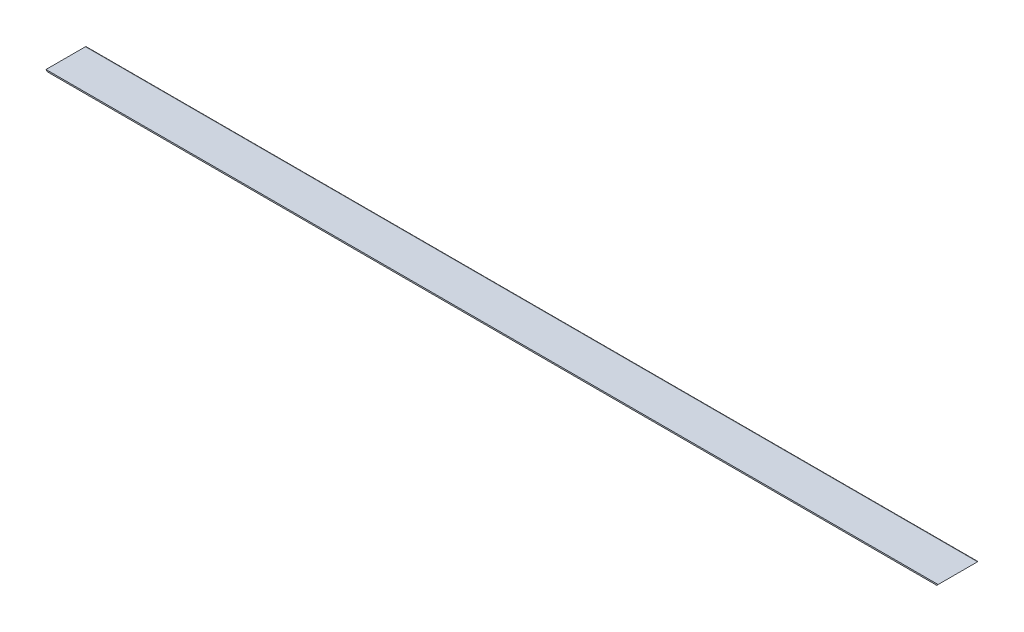
from build123d import *

# Parameters (mm, degrees)
BOSS_EXTRUDE1_DEPTH = 1930
FILLET1_R           = 3
CUT_EXTRUDE1_DEPTH  = 88
CUT_EXTRUDE2_DEPTH  = 88


with BuildPart() as part:
    # Sketch1 → Boss-Extrude1 (new body)
    with BuildSketch(Plane(origin=(0, 0, 0), x_dir=(0, 0, -1), z_dir=(1, 0, 0))):
        Polygon((0, 0), (88, 0), (88, -88), (85, -88), (85, -3), (0, -3), align=None)
    extrude(amount=BOSS_EXTRUDE1_DEPTH)

    # Fillet1
    fillet1_edges = [part.edges().sort_by_distance(p)[0] for p in [
        (965, 0, -88),
        (965, -3, -85),
    ]]
    fillet(fillet1_edges, radius=FILLET1_R)

    # Sketch2 → Cut-Extrude1 (cut)
    with BuildSketch(Plane(origin=(0, 0, -88), x_dir=(-1, 0, 0), z_dir=(0, 0, -1))):
        Polygon((0, 0), (-88, -88), (0, -88), align=None)
    extrude(amount=-CUT_EXTRUDE1_DEPTH, mode=Mode.SUBTRACT)

    # Sketch3 → Cut-Extrude2 (cut)
    with BuildSketch(Plane(origin=(0, 0, -88), x_dir=(-1, 0, 0), z_dir=(0, 0, -1))):
        Polygon((-1930, 0), (-1842, -88), (-1930, -88), align=None)
    extrude(amount=-CUT_EXTRUDE2_DEPTH, mode=Mode.SUBTRACT)


solid = part.part
